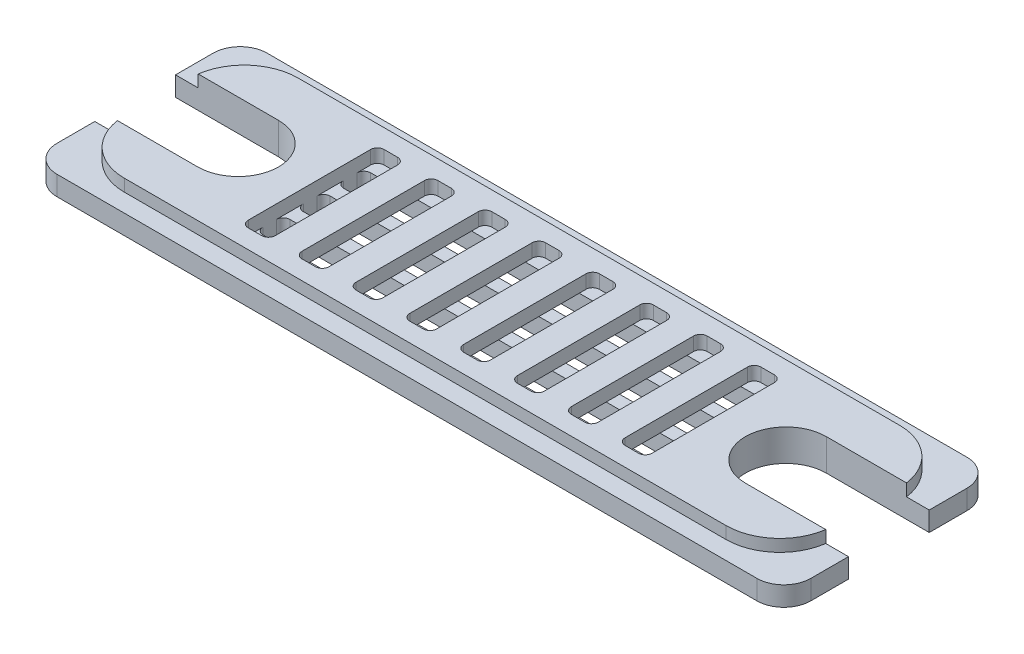
from build123d import *

# Parameters (mm, degrees)
BOSS_EXTRUDE1_DEPTH = 1.45
BOSS_EXTRUDE2_DEPTH = 0.9
CUT_EXTRUDE1_DEPTH  = 1
CUT_EXTRUDE2_REACH  = 31.097
CUT_EXTRUDE3_DEPTH  = 30.160975635


with BuildPart() as part:
    # Sketch1 → Boss-Extrude1 (new body)
    with BuildSketch(Plane(origin=(0, 0, 0), x_dir=(1, 0, 0), z_dir=(0, 1, 0))):
        with BuildLine():
            Line((-26, -7.8), (26, -7.8))
            ThreePointArc((26, -7.8), (27.414213562, -7.214213562), (28, -5.8))
            Line((28, -5.8), (28, 5.8))
            ThreePointArc((28, 5.8), (27.414213562, 7.214213562), (26, 7.8))
            Line((26, 7.8), (-26, 7.8))
            ThreePointArc((-26, 7.8), (-27.414213562, 7.214213562), (-28, 5.8))
            Line((-28, 5.8), (-28, -5.8))
            ThreePointArc((-28, -5.8), (-27.414213562, -7.214213562), (-26, -7.8))
        make_face()
    extrude(amount=BOSS_EXTRUDE1_DEPTH)

    # Sketch2 → Boss-Extrude2 (add)
    with BuildSketch(Plane(origin=(0, 1.45, 0), x_dir=(1, 0, 0), z_dir=(0, 1, 0))):
        with BuildLine():
            Line((-22.35, -6.45), (22.35, -6.45))
            ThreePointArc((22.35, -6.45), (25.178427125, -5.278427125), (26.35, -2.45))
            Line((26.35, -2.45), (26.35, 2.45))
            ThreePointArc((26.35, 2.45), (25.178427125, 5.278427125), (22.35, 6.45))
            Line((22.35, 6.45), (-22.35, 6.45))
            ThreePointArc((-22.35, 6.45), (-25.178427125, 5.278427125), (-26.35, 2.45))
            Line((-26.35, 2.45), (-26.35, -2.45))
            ThreePointArc((-26.35, -2.45), (-25.178427125, -5.278427125), (-22.35, -6.45))
        make_face()
    extrude(amount=BOSS_EXTRUDE2_DEPTH)

    # Sketch3 → Cut-Extrude1 (cut)
    with BuildSketch(Plane(origin=(0, 2.35, 0), x_dir=(1, 0, 0), z_dir=(0, 1, 0))):
        with BuildLine():
            Line((-14.55, 5.046139044), (-13.55, 5.046139044))
            ThreePointArc((-13.55, 5.046139044), (-13.196446609, 4.899692435), (-13.05, 4.546139044))
            Line((-13.05, 4.546139044), (-13.05, -4.546139044))
            ThreePointArc((-13.05, -4.546139044), (-13.196446609, -4.899692435), (-13.55, -5.046139044))
            Line((-13.55, -5.046139044), (-14.55, -5.046139044))
            ThreePointArc((-14.55, -5.046139044), (-14.903553391, -4.899692435), (-15.05, -4.546139044))
            Line((-15.05, -4.546139044), (-15.05, 4.546139044))
            ThreePointArc((-15.05, 4.546139044), (-14.903553391, 4.899692435), (-14.55, 5.046139044))
        make_face()
        with BuildLine():
            Line((-10.55, 5.046139044), (-9.55, 5.046139044))
            ThreePointArc((-9.55, 5.046139044), (-9.196446609, 4.899692435), (-9.05, 4.546139044))
            Line((-9.05, 4.546139044), (-9.05, -4.546139044))
            ThreePointArc((-9.05, -4.546139044), (-9.196446609, -4.899692435), (-9.55, -5.046139044))
            Line((-9.55, -5.046139044), (-10.55, -5.046139044))
            ThreePointArc((-10.55, -5.046139044), (-10.903553391, -4.899692435), (-11.05, -4.546139044))
            Line((-11.05, -4.546139044), (-11.05, 4.546139044))
            ThreePointArc((-11.05, 4.546139044), (-10.903553391, 4.899692435), (-10.55, 5.046139044))
        make_face()
        with BuildLine():
            Line((-6.55, 5.046139044), (-5.55, 5.046139044))
            ThreePointArc((-5.55, 5.046139044), (-5.196446609, 4.899692435), (-5.05, 4.546139044))
            Line((-5.05, 4.546139044), (-5.05, -4.546139044))
            ThreePointArc((-5.05, -4.546139044), (-5.196446609, -4.899692435), (-5.55, -5.046139044))
            Line((-5.55, -5.046139044), (-6.55, -5.046139044))
            ThreePointArc((-6.55, -5.046139044), (-6.903553391, -4.899692435), (-7.05, -4.546139044))
            Line((-7.05, -4.546139044), (-7.05, 4.546139044))
            ThreePointArc((-7.05, 4.546139044), (-6.903553391, 4.899692435), (-6.55, 5.046139044))
        make_face()
        with BuildLine():
            Line((-2.55, 5.046139044), (-1.55, 5.046139044))
            ThreePointArc((-1.55, 5.046139044), (-1.196446609, 4.899692435), (-1.05, 4.546139044))
            Line((-1.05, 4.546139044), (-1.05, -4.546139044))
            ThreePointArc((-1.05, -4.546139044), (-1.196446609, -4.899692435), (-1.55, -5.046139044))
            Line((-1.55, -5.046139044), (-2.55, -5.046139044))
            ThreePointArc((-2.55, -5.046139044), (-2.903553391, -4.899692435), (-3.05, -4.546139044))
            Line((-3.05, -4.546139044), (-3.05, 4.546139044))
            ThreePointArc((-3.05, 4.546139044), (-2.903553391, 4.899692435), (-2.55, 5.046139044))
        make_face()
        with BuildLine():
            Line((1.45, 5.046139044), (2.45, 5.046139044))
            ThreePointArc((2.45, 5.046139044), (2.803553391, 4.899692435), (2.95, 4.546139044))
            Line((2.95, 4.546139044), (2.95, -4.546139044))
            ThreePointArc((2.95, -4.546139044), (2.803553391, -4.899692435), (2.45, -5.046139044))
            Line((2.45, -5.046139044), (1.45, -5.046139044))
            ThreePointArc((1.45, -5.046139044), (1.096446609, -4.899692435), (0.95, -4.546139044))
            Line((0.95, -4.546139044), (0.95, 4.546139044))
            ThreePointArc((0.95, 4.546139044), (1.096446609, 4.899692435), (1.45, 5.046139044))
        make_face()
        with BuildLine():
            Line((5.45, 5.046139044), (6.45, 5.046139044))
            ThreePointArc((6.45, 5.046139044), (6.803553391, 4.899692435), (6.95, 4.546139044))
            Line((6.95, 4.546139044), (6.95, -4.546139044))
            ThreePointArc((6.95, -4.546139044), (6.803553391, -4.899692435), (6.45, -5.046139044))
            Line((6.45, -5.046139044), (5.45, -5.046139044))
            ThreePointArc((5.45, -5.046139044), (5.096446609, -4.899692435), (4.95, -4.546139044))
            Line((4.95, -4.546139044), (4.95, 4.546139044))
            ThreePointArc((4.95, 4.546139044), (5.096446609, 4.899692435), (5.45, 5.046139044))
        make_face()
        with BuildLine():
            Line((9.45, 5.046139044), (10.45, 5.046139044))
            ThreePointArc((10.45, 5.046139044), (10.803553391, 4.899692435), (10.95, 4.546139044))
            Line((10.95, 4.546139044), (10.95, -4.546139044))
            ThreePointArc((10.95, -4.546139044), (10.803553391, -4.899692435), (10.45, -5.046139044))
            Line((10.45, -5.046139044), (9.45, -5.046139044))
            ThreePointArc((9.45, -5.046139044), (9.096446609, -4.899692435), (8.95, -4.546139044))
            Line((8.95, -4.546139044), (8.95, 4.546139044))
            ThreePointArc((8.95, 4.546139044), (9.096446609, 4.899692435), (9.45, 5.046139044))
        make_face()
        with BuildLine():
            Line((13.45, 5.046139044), (14.45, 5.046139044))
            ThreePointArc((14.45, 5.046139044), (14.803553391, 4.899692435), (14.95, 4.546139044))
            Line((14.95, 4.546139044), (14.95, -4.546139044))
            ThreePointArc((14.95, -4.546139044), (14.803553391, -4.899692435), (14.45, -5.046139044))
            Line((14.45, -5.046139044), (13.45, -5.046139044))
            ThreePointArc((13.45, -5.046139044), (13.096446609, -4.899692435), (12.95, -4.546139044))
            Line((12.95, -4.546139044), (12.95, 4.546139044))
            ThreePointArc((12.95, 4.546139044), (13.096446609, 4.899692435), (13.45, 5.046139044))
        make_face()
    extrude(amount=-CUT_EXTRUDE1_DEPTH, mode=Mode.SUBTRACT)

    # Sketch4 → Cut-Extrude2 (cut, up to next)
    with BuildSketch(Plane(origin=(0, 1.35, 0), x_dir=(1, 0, 0), z_dir=(0, 1, 0)), mode=Mode.PRIVATE) as cut_extrude2_sk1:
        with BuildLine():
            Line((-14.55, 4.046139044), (14.45, 4.046139044))
            ThreePointArc((14.45, 4.046139044), (14.803553391, 3.899692435), (14.95, 3.546139044))
            Line((14.95, 3.546139044), (14.95, 2.546139044))
            ThreePointArc((14.95, 2.546139044), (14.803553391, 2.192585654), (14.45, 2.046139044))
            Line((14.45, 2.046139044), (-14.55, 2.046139044))
            ThreePointArc((-14.55, 2.046139044), (-14.903553391, 2.192585654), (-15.05, 2.546139044))
            Line((-15.05, 2.546139044), (-15.05, 3.546139044))
            ThreePointArc((-15.05, 3.546139044), (-14.903553391, 3.899692435), (-14.55, 4.046139044))
        make_face()
    cut_extrude2_tool1 = extrude(cut_extrude2_sk1.sketch, amount=-CUT_EXTRUDE2_REACH, mode=Mode.PRIVATE) & part.part
    # Sketch4 → Cut-Extrude2 (cut, up to next)
    with BuildSketch(Plane(origin=(0, 1.35, 0), x_dir=(1, 0, 0), z_dir=(0, 1, 0)), mode=Mode.PRIVATE) as cut_extrude2_sk2:
        with BuildLine():
            Line((-14.55, 1.046139044), (14.45, 1.046139044))
            ThreePointArc((14.45, 1.046139044), (14.803553391, 0.899692435), (14.95, 0.546139044))
            Line((14.95, 0.546139044), (14.95, -0.453860956))
            ThreePointArc((14.95, -0.453860956), (14.803553391, -0.807414346), (14.45, -0.953860956))
            Line((14.45, -0.953860956), (-14.55, -0.953860956))
            ThreePointArc((-14.55, -0.953860956), (-14.903553391, -0.807414346), (-15.05, -0.453860956))
            Line((-15.05, -0.453860956), (-15.05, 0.546139044))
            ThreePointArc((-15.05, 0.546139044), (-14.903553391, 0.899692435), (-14.55, 1.046139044))
        make_face()
    cut_extrude2_tool2 = extrude(cut_extrude2_sk2.sketch, amount=-CUT_EXTRUDE2_REACH, mode=Mode.PRIVATE) & part.part
    # Sketch4 → Cut-Extrude2 (cut, up to next)
    with BuildSketch(Plane(origin=(0, 1.35, 0), x_dir=(1, 0, 0), z_dir=(0, 1, 0)), mode=Mode.PRIVATE) as cut_extrude2_sk3:
        with BuildLine():
            Line((-14.55, -1.953860956), (14.45, -1.953860956))
            ThreePointArc((14.45, -1.953860956), (14.803553391, -2.100307565), (14.95, -2.453860956))
            Line((14.95, -2.453860956), (14.95, -3.453860956))
            ThreePointArc((14.95, -3.453860956), (14.803553391, -3.807414346), (14.45, -3.953860956))
            Line((14.45, -3.953860956), (-14.55, -3.953860956))
            ThreePointArc((-14.55, -3.953860956), (-14.903553391, -3.807414346), (-15.05, -3.453860956))
            Line((-15.05, -3.453860956), (-15.05, -2.453860956))
            ThreePointArc((-15.05, -2.453860956), (-14.903553391, -2.100307565), (-14.55, -1.953860956))
        make_face()
    cut_extrude2_tool3 = extrude(cut_extrude2_sk3.sketch, amount=-CUT_EXTRUDE2_REACH, mode=Mode.PRIVATE) & part.part
    add(cut_extrude2_tool1.solids().sort_by_distance((-0.05, 1.35, -3.046139))[0], mode=Mode.SUBTRACT)
    add(cut_extrude2_tool2.solids().sort_by_distance((-0.05, 1.35, -0.046139))[0], mode=Mode.SUBTRACT)
    add(cut_extrude2_tool3.solids().sort_by_distance((-0.05, 1.35, 2.953861))[0], mode=Mode.SUBTRACT)

    # Sketch5 → Cut-Extrude3 (cut, through all)
    with BuildSketch(Plane(origin=(0, 2.35, 0), x_dir=(1, 0, 0), z_dir=(0, 1, 0))):
        with BuildLine():
            Line((-20.35, 3), (-28, 3))
            Line((-28, 3), (-28, -3))
            Line((-28, -3), (-20.35, -3))
            ThreePointArc((-20.35, -3), (-17.35, 0), (-20.35, 3))
        make_face()
        with BuildLine():
            Line((20.35, -3), (28, -3))
            Line((28, -3), (28, 3))
            Line((28, 3), (20.35, 3))
            ThreePointArc((20.35, 3), (17.35, 0), (20.35, -3))
        make_face()
    extrude(amount=-CUT_EXTRUDE3_DEPTH, mode=Mode.SUBTRACT)


solid = part.part
